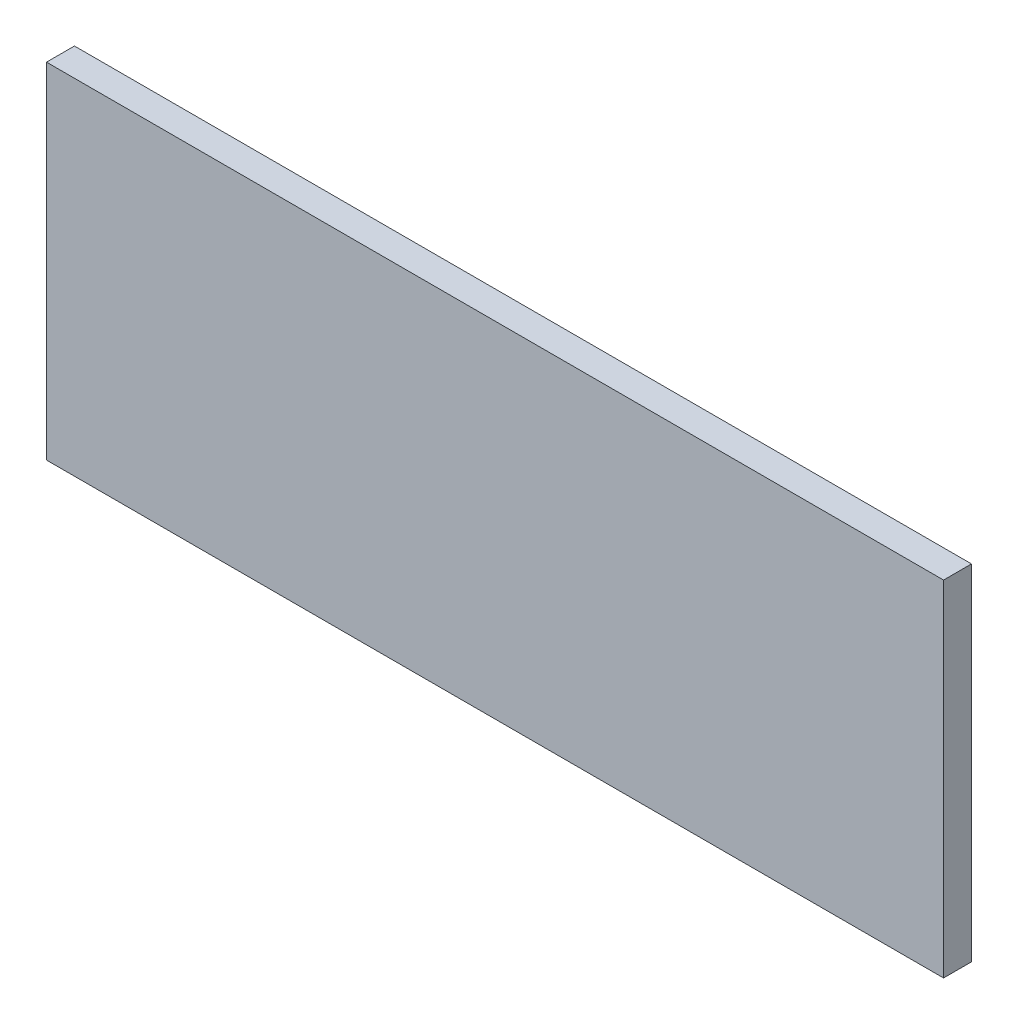
from build123d import *

# Parameters (mm, degrees)
SKETCH1_W           = 64.211985319
SKETCH1_H           = 24.669999809
BOSS_EXTRUDE1_DEPTH = 2


with BuildPart() as part:
    # Sketch1 → Boss-Extrude1 (new body)
    with BuildSketch(Plane.XY):
        with Locations((7.261028313, 19.333581411)):
            Rectangle(SKETCH1_W, SKETCH1_H)
    extrude(amount=BOSS_EXTRUDE1_DEPTH)


solid = part.part
